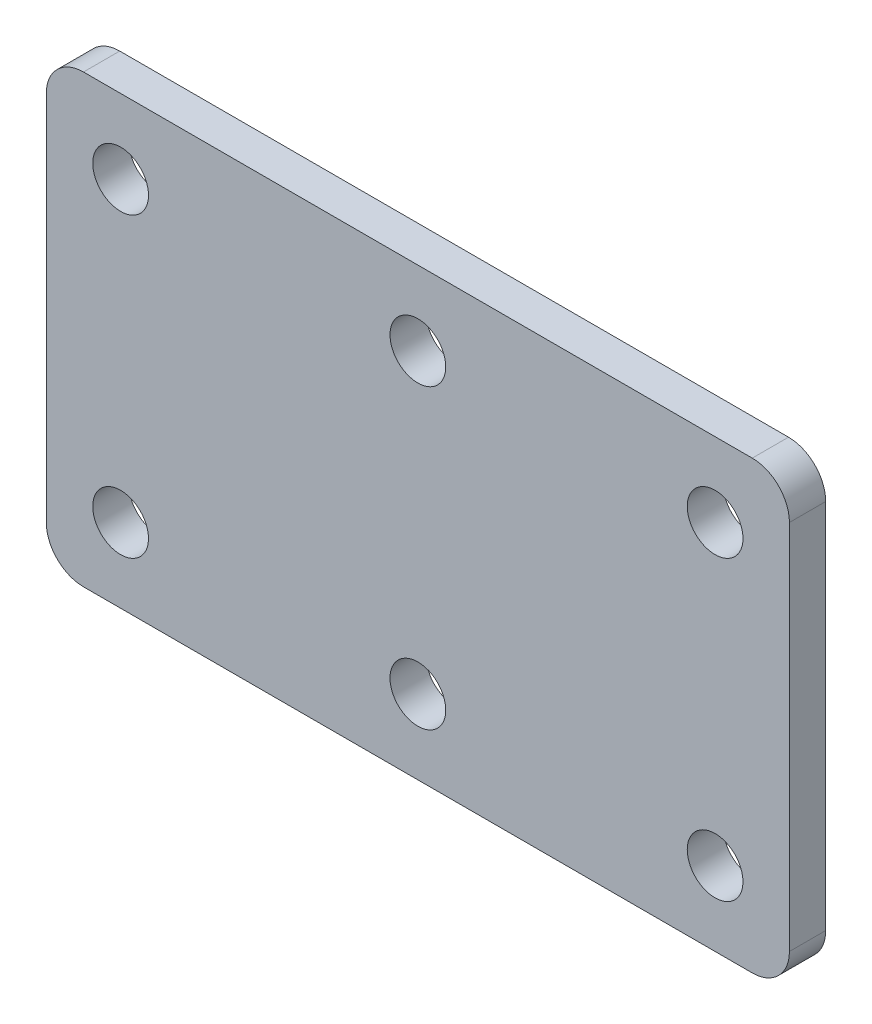
from build123d import *

# Parameters (mm, degrees)
SKETCH1_W           = 76.2
SKETCH1_H           = 50.8
SKETCH1_R           = 2.38125
BOSS_EXTRUDE1_DEPTH = 3.0988
FILLET1_R           = 3.175
SKETCH2_W           = 63.5
SKETCH2_H           = 38.1
CUT_EXTRUDE1_DEPTH  = 46.895234627
FILLET3_R           = 3.175


with BuildPart() as part:
    # Sketch1 → Boss-Extrude1 (new body)
    with BuildSketch(Plane.XY):
        Rectangle(SKETCH1_W, SKETCH1_H)
        with Locations((-25.4, 12.7)):
            Circle(SKETCH1_R, mode=Mode.SUBTRACT)
        with Locations((0, 12.7)):
            Circle(SKETCH1_R, mode=Mode.SUBTRACT)
        with Locations((25.4, 12.7)):
            Circle(SKETCH1_R, mode=Mode.SUBTRACT)
        with Locations(Location((25.4, -12.7, 0), (0, 0, 180))):
            Circle(SKETCH1_R, mode=Mode.SUBTRACT)
        with Locations(Location((0, -12.7, 0), (0, 0, 180))):
            Circle(SKETCH1_R, mode=Mode.SUBTRACT)
        with Locations(Location((-25.4, -12.7, 0), (0, 0, 180))):
            Circle(SKETCH1_R, mode=Mode.SUBTRACT)
    extrude(amount=BOSS_EXTRUDE1_DEPTH)

    # Fillet1
    fillet1_edges = [part.edges().sort_by_distance(p)[0] for p in [
        (-38.1, 25.4, 1.5494),
        (38.1, 25.4, 1.5494),
        (38.1, -25.4, 1.5494),
        (-38.1, -25.4, 1.5494),
    ]]
    fillet(fillet1_edges, radius=FILLET1_R)

    # Sketch2 → Cut-Extrude1 (cut, through all)
    with BuildSketch(Plane.XY.offset(3.0988)):
        with BuildLine():
            Line((38.1, -22.225), (38.1, 22.225))
            ThreePointArc((38.1, 22.225), (37.17006403, 24.47006403), (34.925, 25.4))
            Line((34.925, 25.4), (-34.925, 25.4))
            ThreePointArc((-34.925, 25.4), (-37.17006403, 24.47006403), (-38.1, 22.225))
            Line((-38.1, 22.225), (-38.1, -22.225))
            ThreePointArc((-38.1, -22.225), (-37.17006403, -24.47006403), (-34.925, -25.4))
            Line((-34.925, -25.4), (34.925, -25.4))
            ThreePointArc((34.925, -25.4), (37.17006403, -24.47006403), (38.1, -22.225))
        make_face()
        Rectangle(SKETCH2_W, SKETCH2_H, mode=Mode.SUBTRACT)
    extrude(amount=-CUT_EXTRUDE1_DEPTH, mode=Mode.SUBTRACT)

    # Fillet3
    fillet3_edges = [part.edges().sort_by_distance(p)[0] for p in [
        (31.75, -19.05, 1.5494),
        (-31.75, -19.05, 1.5494),
        (-31.75, 19.05, 1.5494),
        (31.75, 19.05, 1.5494),
    ]]
    fillet(fillet3_edges, radius=FILLET3_R)


solid = part.part
